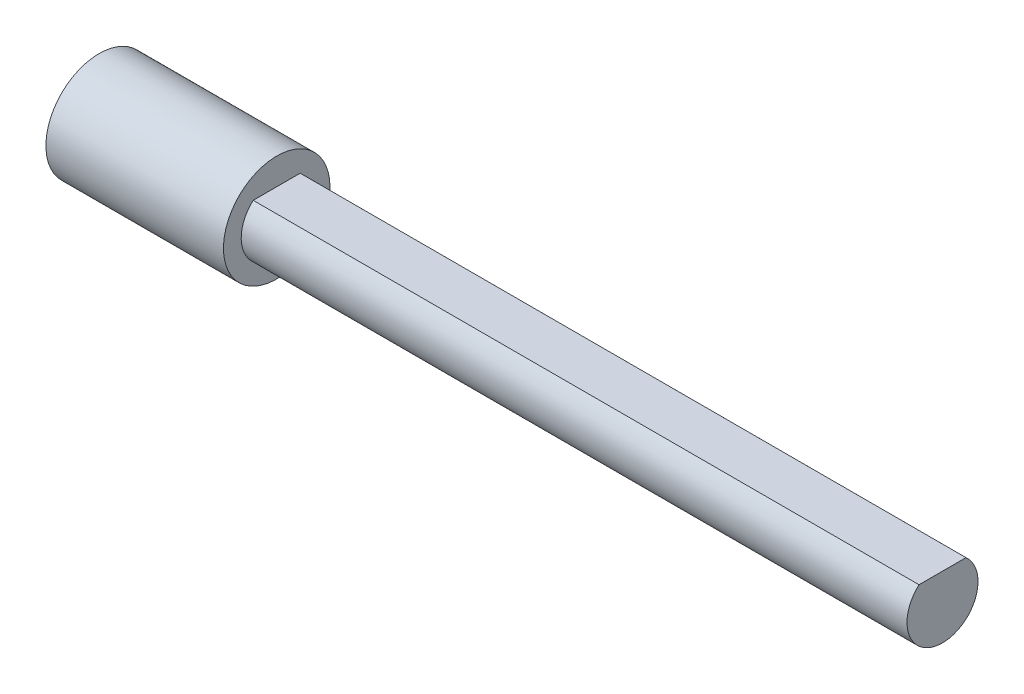
from build123d import *

# Parameters (mm, degrees)
SKETCH1_R           = 6
BOSS_EXTRUDE1_DEPTH = 20
CUT_EXTRUDE1_DEPTH  = 15
BOSS_EXTRUDE2_DEPTH = 75


with BuildPart() as part:
    # Sketch1 → Boss-Extrude1 (new body)
    with BuildSketch(Plane(origin=(0, 0, 0), x_dir=(0, 0, -1), z_dir=(1, 0, 0))):
        Circle(SKETCH1_R)
    extrude(amount=BOSS_EXTRUDE1_DEPTH)

    # Sketch2 → Cut-Extrude1 (cut)
    with BuildSketch(Plane.ZY):
        with BuildLine():
            Line((-2.683281573, 3.1), (2.683281573, 3.1))
            ThreePointArc((2.683281573, 3.1), (4.1, 0), (2.683281573, -3.1))
            Line((2.683281573, -3.1), (-2.683281573, -3.1))
            ThreePointArc((-2.683281573, -3.1), (-4.1, 0), (-2.683281573, 3.1))
        make_face()
    extrude(amount=-CUT_EXTRUDE1_DEPTH, mode=Mode.SUBTRACT)

    # Sketch3 → Boss-Extrude2 (add)
    with BuildSketch(Plane(origin=(20, 0, 0), x_dir=(0, 0, -1), z_dir=(1, 0, 0))):
        with BuildLine():
            Line((2.645751311, 3), (-2.645751311, 3))
            ThreePointArc((-2.645751311, 3), (0, -4), (2.645751311, 3))
        make_face()
    extrude(amount=BOSS_EXTRUDE2_DEPTH)


solid = part.part
